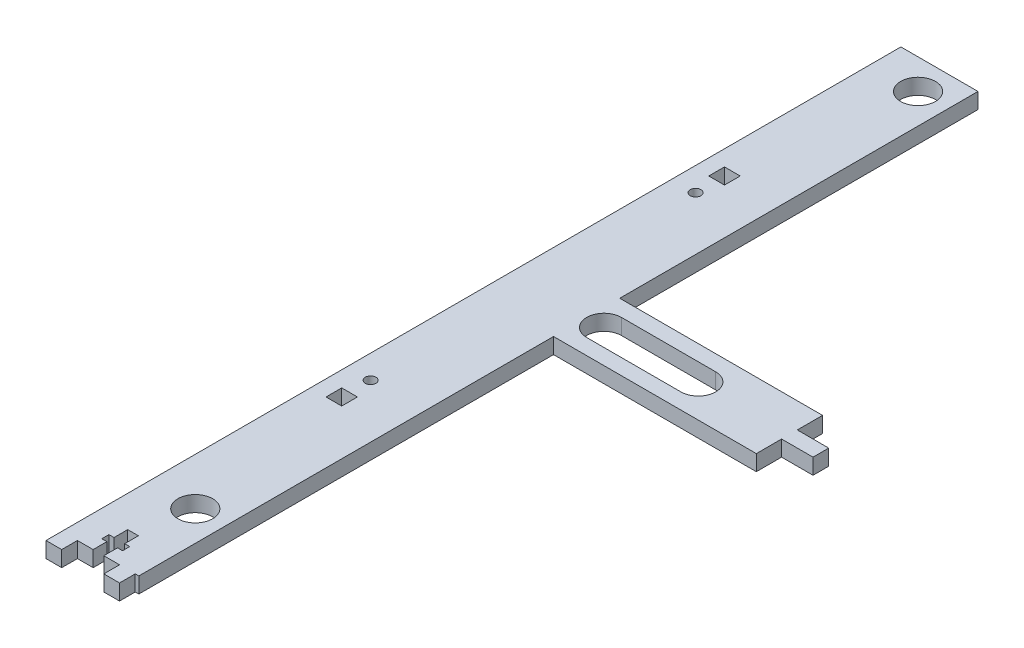
from build123d import *

# Parameters (mm, degrees)
AXLE_SUPPORT_PLATE_R   = 7.030128061
AXLE_SUPPORT_PLATE_R_2 = 2.159
AXLE_SUPPORT_PLATE_W   = 6.35
AXLE_SUPPORT_PLATE_H   = 6.35
BOSS_EXTRUDE1_DEPTH    = 6.35


with BuildPart() as part:
    # Axle Support Plate → Boss-Extrude1 (new body)
    with BuildSketch(Plane(origin=(0, 0, 0), x_dir=(1, 0, 0), z_dir=(0, 1, 0))):
        Polygon((31.160128061, -180.975), (31.160128061, -13.380128061), (113.120256121, -13.380128061), (113.120256121, -3.175), (125.820256121, -3.175), (125.820256121, 3.175), (113.120256121, 3.175), (113.120256121, 13.380128061), (31.160128061, 13.380128061), (31.160128061, 158.160128061), (0, 158.160128061), (0, -187.325), (6.35, -187.325), (6.35, -180.975), (12.7, -180.975), (12.7, -175.440000021), (10.659000018, -175.440000021), (10.659000018, -172.539999979), (12.7, -172.539999979), (12.7, -167.005), (17.018, -167.005), (17.018, -172.539999979), (19.058999982, -172.539999979), (19.058999982, -175.440000021), (17.018, -175.440000021), (17.018, -180.975), (23.368, -180.975), (23.368, -187.325), (29.718, -187.325), (29.718, -180.975), align=None)
        with Locations(Location((19.05, 146.05, 0), (0, 0, 270))):
            Circle(AXLE_SUPPORT_PLATE_R, mode=Mode.SUBTRACT)
        with Locations(Location((19.05, -146.05, 0), (0, 0, 90))):
            Circle(AXLE_SUPPORT_PLATE_R, mode=Mode.SUBTRACT)
        with Locations(Location((9.525, 65.659, 0), (0, 0, 270))):
            Circle(AXLE_SUPPORT_PLATE_R_2, mode=Mode.SUBTRACT)
        with Locations(Location((9.525, -65.659, 0), (0, 0, 90))):
            Circle(AXLE_SUPPORT_PLATE_R_2, mode=Mode.SUBTRACT)
        with Locations((9.525, -77.343)):
            Rectangle(AXLE_SUPPORT_PLATE_W, AXLE_SUPPORT_PLATE_H, mode=Mode.SUBTRACT)
        with Locations((9.525, 77.343)):
            Rectangle(AXLE_SUPPORT_PLATE_W, AXLE_SUPPORT_PLATE_H, mode=Mode.SUBTRACT)
        with BuildLine():
            Line((38.190256121, 7.030128061), (76.290256121, 7.030128061))
            ThreePointArc((76.290256121, 7.030128061), (83.320384182, 0), (76.290256121, -7.030128061))
            Line((76.290256121, -7.030128061), (38.190256121, -7.030128061))
            ThreePointArc((38.190256121, -7.030128061), (31.160128061, 0), (38.190256121, 7.030128061))
        make_face(mode=Mode.SUBTRACT)
    extrude(amount=BOSS_EXTRUDE1_DEPTH)


solid = part.part
